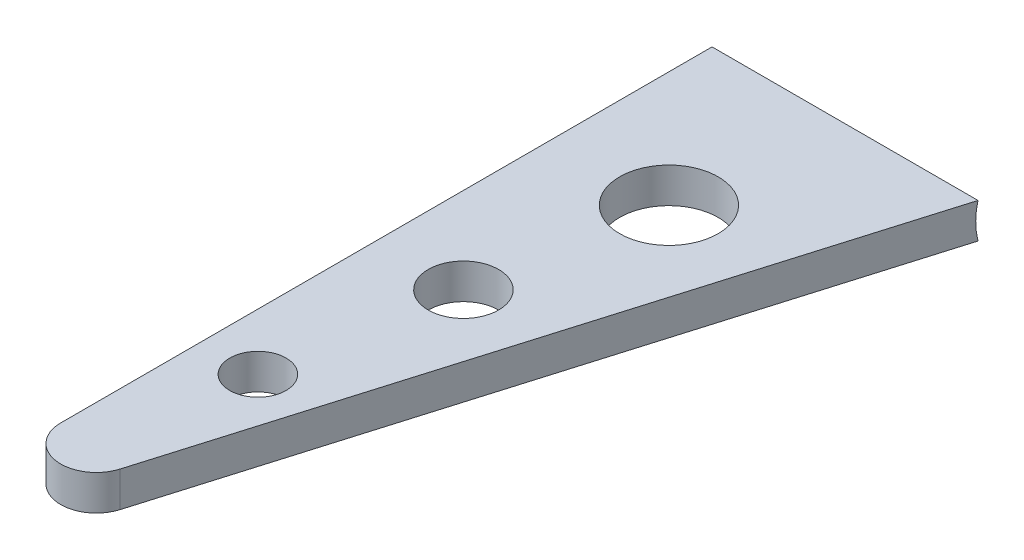
from build123d import *

# Parameters (mm, degrees)
SKETCH1_R           = 4
SKETCH1_R_2         = 5
SKETCH1_R_3         = 7
BOSS_EXTRUDE1_DEPTH = 5
SKETCH2_R           = 12.7
CUT_EXTRUDE1_DEPTH  = 50


with BuildPart() as part:
    # Sketch1 → Boss-Extrude1 (new body)
    with BuildSketch(Plane(origin=(0, 0, 0), x_dir=(1, 0, 0), z_dir=(0, 1, 0))):
        with BuildLine():
            Line((0, 0), (0, -100))
            ThreePointArc((0, -100), (4.326195296, -105), (9.896144859, -101.437468934))
            Line((9.896144859, -101.437468934), (40, 0))
            Line((40, 0), (0, 0))
        make_face()
        with Locations(Location((8.0237285, -80, 0), (0, 0, 270))):
            Circle(SKETCH1_R, mode=Mode.SUBTRACT)
        with Locations(Location((12.222443443, -55, 0), (0, 0, 270))):
            Circle(SKETCH1_R_2, mode=Mode.SUBTRACT)
        with Locations(Location((16.421158385, -30, 0), (0, 0, 270))):
            Circle(SKETCH1_R_3, mode=Mode.SUBTRACT)
    extrude(amount=BOSS_EXTRUDE1_DEPTH)

    # Sketch2 → Cut-Extrude1 (cut)
    with BuildSketch(Plane.ZY):
        with Locations((-5, 2.5)):
            Circle(SKETCH2_R)
    extrude(amount=-CUT_EXTRUDE1_DEPTH, mode=Mode.SUBTRACT)


solid = part.part
